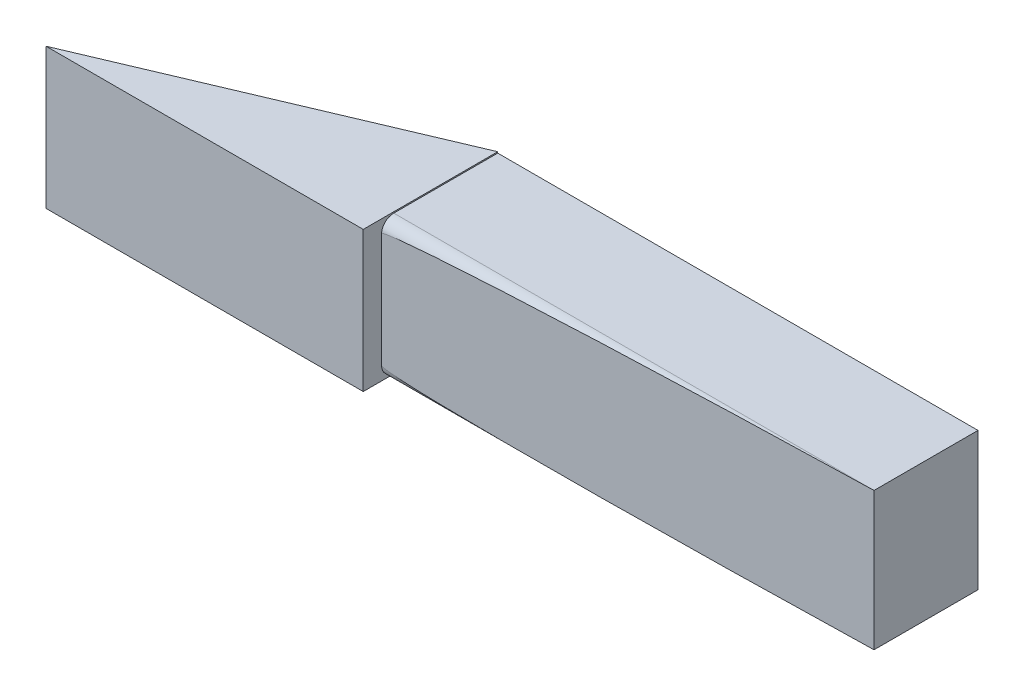
from build123d import *

# Parameters (mm, degrees)
BOSS_EXTRU_1_DEPTH              = 23
ENL_V_MAT_EXTRU_2_DEPTH         = 47.939769219
ENL_V_DE_MAT_EXTRU_MINCE1_DEPTH = 78.627208506


with BuildPart() as part:
    # Esquisse3 → Boss.-Extru.1 (new body)
    with BuildSketch(Plane(origin=(0, 0, 0), x_dir=(1, 0, 0), z_dir=(0, 1, 0))):
        Polygon((-209.233275871, -136.906813661), (-157.293506651, -114.887808395), (-78.666298145, -114.887808395), (-78.666298145, -131.906813661), (-157.293506651, -133.906813661), (-157.293506651, -136.906813661), align=None)
    extrude(amount=-BOSS_EXTRU_1_DEPTH)

    # Esquisse5 → Enlèv. mat.-Extru.2 (cut)
    with BuildSketch(Plane.YZ.offset(-209.233275871)):
        Polygon((-20, 133.906813661), (-20, 117.887808395), (-20, 114.887808395), (-3, 114.887808395), (-3, 117.887808395), (-3, 133.906813661), align=None)
    extrude(amount=ENL_V_MAT_EXTRU_2_DEPTH, mode=Mode.SUBTRACT)

    # Esquisse6 → Enlèv. de mat.-Extru.-Mince1 (cut)
    with BuildSketch(Plane(origin=(-78.666298145, 0, 0), x_dir=(0, 0, -1), z_dir=(1, 0, 0))):
        with BuildLine():
            Line((-134.906813661, -20.8), (-134.906813661, -1.954954154))
            ThreePointArc((-134.906813661, -1.954954154), (-133.945165816, 0.010427616), (-131.904561119, 0.8))
            Line((-131.904561119, 0.8), (-113.24643884, 0.8))
            Line((-113.24643884, 0.8), (-113.24643884, -23.8))
            Line((-113.24643884, -23.8), (-131.906813661, -23.8))
            ThreePointArc((-131.906813661, -23.8), (-134.028134004, -22.921320344), (-134.906813661, -20.8))
        make_face()
        with BuildLine():
            Line((-133.906813661, -20.8), (-133.906813661, -2))
            ThreePointArc((-133.906813661, -2), (-133.254765726, -0.713386594), (-131.906813661, -0.2))
            Line((-131.906813661, -0.2), (-114.24643884, -0.2))
            Line((-114.24643884, -0.2), (-114.24643884, -22.8))
            Line((-114.24643884, -22.8), (-131.906813661, -22.8))
            ThreePointArc((-131.906813661, -22.8), (-133.321027223, -22.214213562), (-133.906813661, -20.8))
        make_face(mode=Mode.SUBTRACT)
    extrude(amount=-ENL_V_DE_MAT_EXTRU_MINCE1_DEPTH, mode=Mode.SUBTRACT)


solid = part.part
